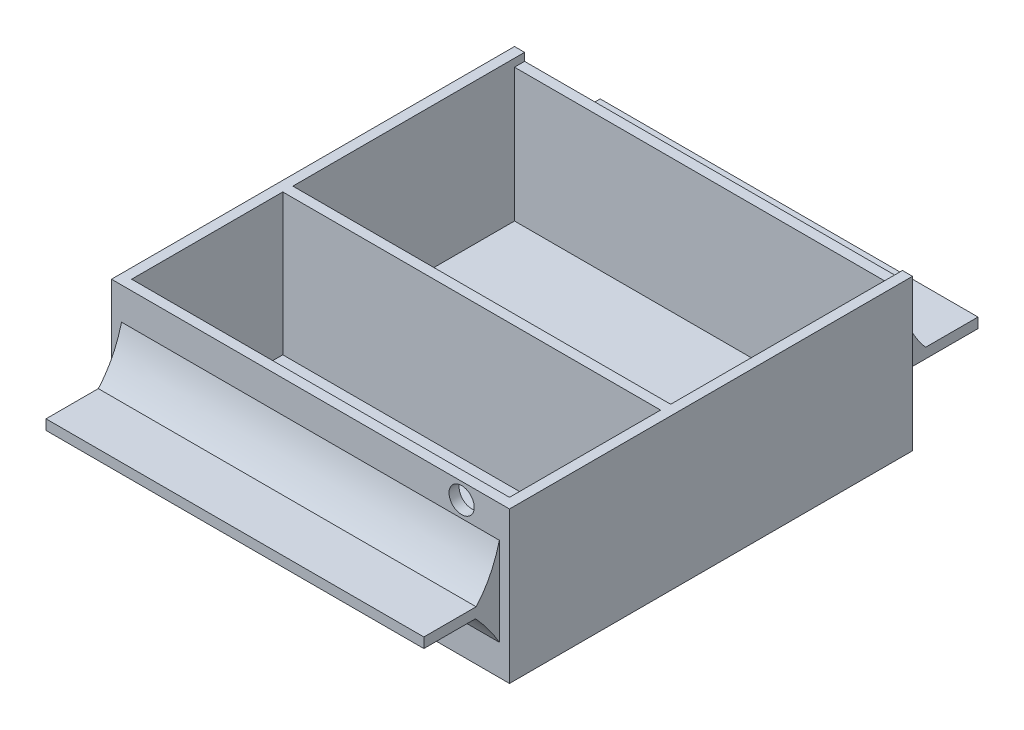
from build123d import *

# Parameters (mm, degrees)
EXTRUDE_1_DEPTH     = 150
SKETCH_2_W          = 160
SKETCH_2_H          = 60
EXTRUDE_2_DEPTH     = 4
SKETCH_3_W          = 160
SKETCH_3_H          = 60
EXTRUDE_3_DEPTH     = 4
EXTRUDE_5_DEPTH     = 150
SKETCH_8_W          = 30
SKETCH_8_H          = 4
EXTRUDE_6_DEPTH     = 150
CUT_EXTRUDE_1_REACH = 272.328
SKETCH_10_R         = 10
CUT_EXTRUDE_2_DEPTH = 10
SKETCH_11_R         = 5
CUT_EXTRUDE_3_DEPTH = 10


with BuildPart() as part:
    # 草图1 → 凸台-拉伸1 (new body)
    with BuildSketch(Plane(origin=(0, 0, 0), x_dir=(0, 0, -1), z_dir=(1, 0, 0))):
        Polygon((30, 31), (30, 0), (0, 0), (0, -4), (30, -4), (30, -29), (190, -29), (190, 27.892594103), (186, 27.892594103), (186, -25), (98, -25), (98, 31), (94, 31), (94, -25), (34, -25), (34, 31), align=None)
    extrude(amount=EXTRUDE_1_DEPTH)

    # 草图2 → 凸台-拉伸2 (add)
    with BuildSketch(Plane(origin=(150, 0, 0), x_dir=(0, 0, -1), z_dir=(1, 0, 0))):
        with Locations((110, 1)):
            Rectangle(SKETCH_2_W, SKETCH_2_H)
    extrude(amount=EXTRUDE_2_DEPTH)

    # 草图3 → 凸台-拉伸3 (add)
    with BuildSketch(Plane.ZY):
        with Locations((-110, 1)):
            Rectangle(SKETCH_3_W, SKETCH_3_H)
    extrude(amount=EXTRUDE_3_DEPTH)

    # 草图5 → 凸台-拉伸5 (add)
    with BuildSketch(Plane(origin=(150, 0, -30), x_dir=(0, 0, 1), z_dir=(-1, 0, 0))):
        with BuildLine():
            add(Edge.make_bspline(
                [(0, 18.235042401), (2.837739177, 7.092842101), (9.238577647, 0)],
                knots=[0, 0, 0, 1, 1, 1], degree=2))
            Line((9.238577647, 0), (9.33878145, -0.092906558))
            Line((9.33878145, -0.092906558), (0, 0))
            Line((0, 0), (0, 18.235042401))
        make_face()
        with BuildLine():
            Line((0, -4), (0, -16.851035139))
            add(Edge.make_bspline(
                [(0, -16.851035139), (3.667477497, -10.331662623), (9.475645739, -4)],
                knots=[0, 0, 0, 1, 1, 1], degree=2))
            Line((9.475645739, -4), (0, -4))
        make_face()
    extrude_5 = extrude(amount=EXTRUDE_5_DEPTH)

    # 镜向2: 凸台-拉伸5 across plane
    add(extrude_5.mirror(Plane.XY.offset(-110)))

    # 草图8 → 凸台-拉伸6 (add)
    with BuildSketch(Plane(origin=(150, 0, 0), x_dir=(0, 0, -1), z_dir=(1, 0, 0))):
        with Locations((205, -2)):
            Rectangle(SKETCH_8_W, SKETCH_8_H)
    extrude(amount=-EXTRUDE_6_DEPTH)

    # 草图9 → 切除-拉伸1 (cut, up to next)
    with BuildSketch(Plane(origin=(150, 0, 0), x_dir=(0, 0, -1), z_dir=(1, 0, 0)), mode=Mode.PRIVATE) as cut_extrude_1_sk1:
        Polygon((199.475645739, -4), (190, -4), (190, -16.851035139), align=None)
    cut_extrude_1_tool1 = extrude(cut_extrude_1_sk1.sketch, amount=-CUT_EXTRUDE_1_REACH, mode=Mode.PRIVATE) & part.part
    add(cut_extrude_1_tool1.solids().sort_by_distance((150, -8.283678, -193.158549))[0], mode=Mode.SUBTRACT)

    # 草图10 → 切除-拉伸2 (cut)
    with BuildSketch(Plane(origin=(0, 0, -98), x_dir=(-1, 0, 0), z_dir=(0, 0, -1))):
        with Locations(Location((-137.288939056, 2.62555121, 0), (0, 0, 90))):
            Circle(SKETCH_10_R)
    extrude(amount=-CUT_EXTRUDE_2_DEPTH, mode=Mode.SUBTRACT)

    # 草图11 → 切除-拉伸3 (cut)
    with BuildSketch(Plane.XY.offset(-30)):
        with Locations((134.999120895, 24.559728505)):
            Circle(SKETCH_11_R)
    extrude(amount=-CUT_EXTRUDE_3_DEPTH, mode=Mode.SUBTRACT)


solid = part.part
